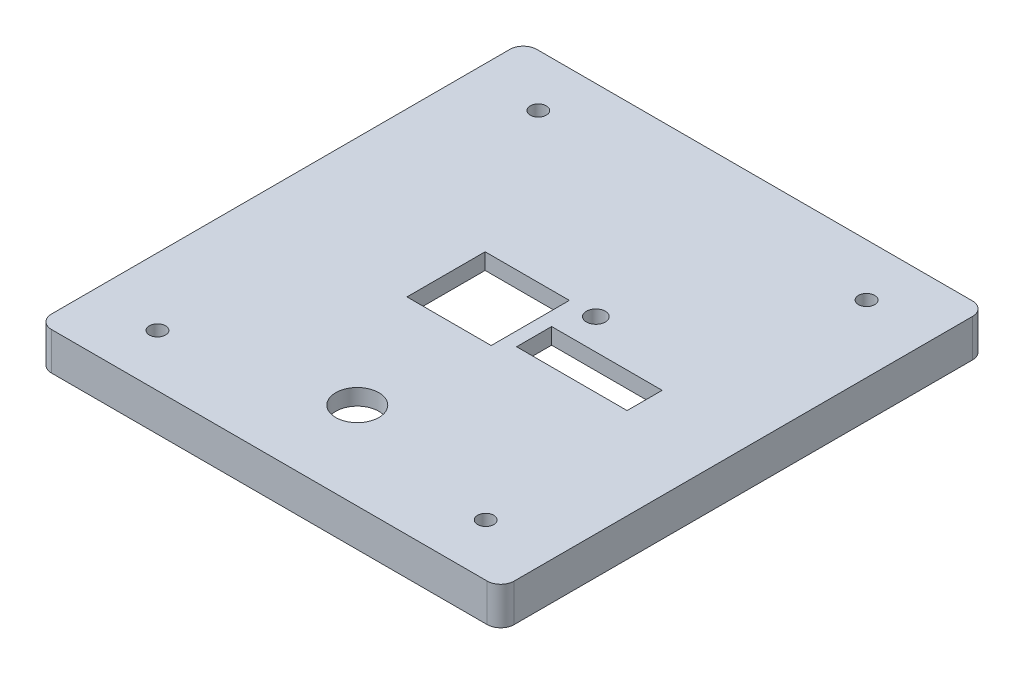
from build123d import *

# Parameters (mm, degrees)
SKETCH_1_W           = 85.8
SKETCH_1_H           = 90
SKETCH_1_W_2         = 65.278
SKETCH_1_H_2         = 75.438
EXTRUDE_1_DEPTH      = 4
SKETCH_6_W           = 85.8
SKETCH_6_H           = 90
EXTRUDE_2_DEPTH      = 3
SKETCH_7_W           = 15.4
SKETCH_7_H           = 7.281
CUT_EXTRUDE_1_DEPTH  = 3
FILLET_1_R           = 2.5
CUT_EXTRUDE_2_DEPTH  = 118.835684599
SKETCH_10_R          = 1.75
CUT_EXTRUDE_3_DEPTH  = 118.835684599
SKETCH_11_W          = 15.621
SKETCH_11_H          = 14.5
CUT_EXTRUDE_4_DEPTH  = 118.835684599
SKETCH_15_R          = 4
CUT_EXTRUDE_8_DEPTH  = 118.835684599
SKETCH_12_R          = 1.5
CUT_EXTRUDE_15_DEPTH = 10


with BuildPart() as part:
    # 草图1 → 凸台-拉伸1 (new body)
    with BuildSketch(Plane(origin=(0, 0, 0), x_dir=(1, 0, 0), z_dir=(0, 1, 0))):
        with Locations((38.264980184, 40.138091102)):
            Rectangle(SKETCH_1_W, SKETCH_1_H)
        with Locations((38.264980184, 40.138091102)):
            Rectangle(SKETCH_1_W_2, SKETCH_1_H_2, mode=Mode.SUBTRACT)
    extrude(amount=EXTRUDE_1_DEPTH)

    # 草图6 → 凸台-拉伸2 (add)
    with BuildSketch(Plane(origin=(0, 4, 0), x_dir=(1, 0, 0), z_dir=(0, 1, 0))):
        with Locations((38.264980184, 40.138091102)):
            Rectangle(SKETCH_6_W, SKETCH_6_H)
    extrude(amount=EXTRUDE_2_DEPTH)

    # 草图7 → 切除-拉伸1 (cut)
    with BuildSketch(Plane.XZ):
        with Locations((61.997000004, -81.497591102)):
            Rectangle(SKETCH_7_W, SKETCH_7_H)
    extrude(amount=-CUT_EXTRUDE_1_DEPTH, mode=Mode.SUBTRACT)

    # 圆角1
    fillet_1_edges = [part.edges().sort_by_distance(p)[0] for p in [
        (-4.635019816, 3.5, -85.138091102),
        (81.164980184, 3.5, -85.138091102),
        (81.164980184, 3.5, 4.861908898),
        (-4.635019816, 3.5, 4.861908898),
    ]]
    fillet(fillet_1_edges, radius=FILLET_1_R)

    # 草图9 → 切除-拉伸2 (cut, through all)
    with BuildSketch(Plane(origin=(0, 7, 0), x_dir=(1, 0, 0), z_dir=(0, 1, 0))):
        Polygon((64.254980184, 41.998091102), (47.299239867, 41.998091102), (43.754980184, 41.998091102), (43.754980184, 35.498091102), (64.254980184, 35.498091102), align=None)
    extrude(amount=-CUT_EXTRUDE_2_DEPTH, mode=Mode.SUBTRACT)

    # 草图10 → 切除-拉伸3 (cut, through all)
    with BuildSketch(Plane(origin=(0, 7, 0), x_dir=(1, 0, 0), z_dir=(0, 1, 0))):
        with Locations(Location((46.264980184, 47.688091102, 0), (0, 0, 270))):
            Circle(SKETCH_10_R)
    extrude(amount=-CUT_EXTRUDE_3_DEPTH, mode=Mode.SUBTRACT)

    # 草图11 → 切除-拉伸4 (cut, through all)
    with BuildSketch(Plane(origin=(0, 7, 0), x_dir=(1, 0, 0), z_dir=(0, 1, 0))):
        with Locations((33.394480184, 40.588091102)):
            Rectangle(SKETCH_11_W, SKETCH_11_H)
    extrude(amount=-CUT_EXTRUDE_4_DEPTH, mode=Mode.SUBTRACT)

    # 草图15 → 切除-拉伸8 (cut, through all)
    with BuildSketch(Plane(origin=(0, 7, 0), x_dir=(1, 0, 0), z_dir=(0, 1, 0))):
        with Locations(Location((38.353887366, 11.356570823, 0), (0, 0, 270))):
            Circle(SKETCH_15_R)
    extrude(amount=-CUT_EXTRUDE_8_DEPTH, mode=Mode.SUBTRACT)

    # 草图12 → 切除-拉伸15 (cut)
    with BuildSketch(Plane(origin=(0, 7, 0), x_dir=(1, 0, 0), z_dir=(0, 1, 0))):
        with Locations(Location((7.825980184, 75.457091102, 0), (0, 0, 270))):
            Circle(SKETCH_12_R)
        with Locations(Location((68.703980184, 75.457091102, 0), (0, 0, 270))):
            Circle(SKETCH_12_R)
        with Locations(Location((7.825980184, 4.819091102, 0), (0, 0, 270))):
            Circle(SKETCH_12_R)
        with Locations(Location((68.703980184, 4.819091102, 0), (0, 0, 270))):
            Circle(SKETCH_12_R)
    extrude(amount=-CUT_EXTRUDE_15_DEPTH, mode=Mode.SUBTRACT)


solid = part.part
